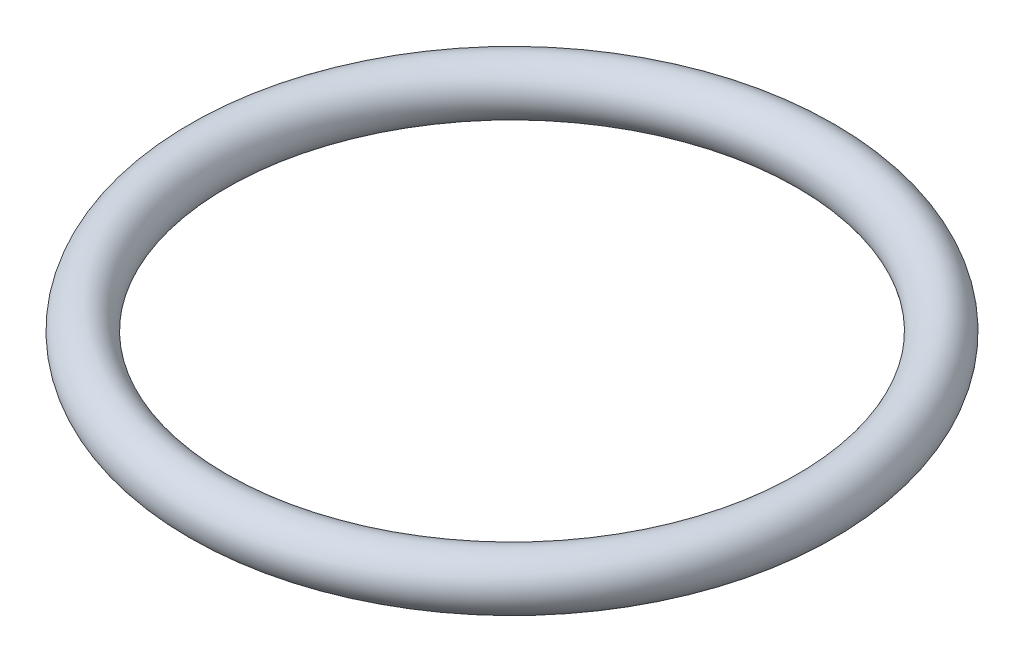
from build123d import *

# Parameters (mm, degrees)
SKETCH1_R = 2.38125


with BuildPart() as part:
    # Sketch1 → Revolve1 (revolve)
    with BuildSketch(Plane.XY, mode=Mode.PRIVATE) as revolve1_sk:
        with Locations((-27.78125, 0)):
            Circle(SKETCH1_R)
    revolve(revolve1_sk.sketch.rotate(Axis((0, 0, 0), (0, 1, 0)), 270), axis=Axis((0, 0, 0), (0, 1, 0)))


solid = part.part
